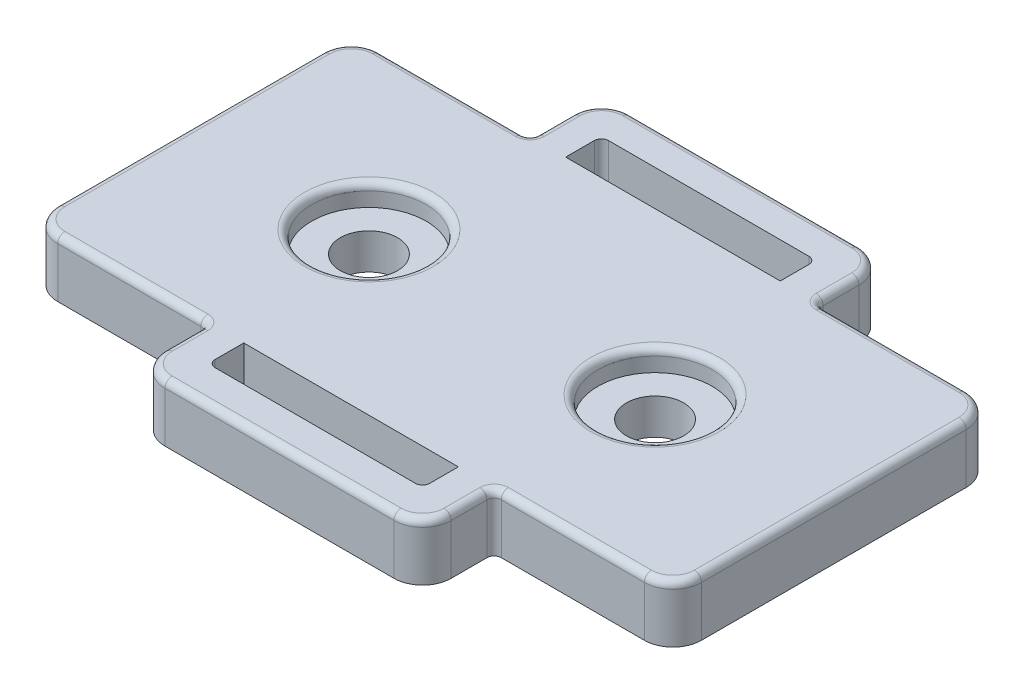
from build123d import *

# Parameters (mm, degrees)
SKETCH_1_R          = 4
EXTRUDE_1_DEPTH     = 8
SKETCH_2_R          = 8
CUT_EXTRUDE_1_DEPTH = 3
CUT_EXTRUDE_2_DEPTH = 3
FILLET_1_R          = 1


with BuildPart() as part:
    # 草图1 → 凸台-拉伸1 (new body)
    with BuildSketch(Plane(origin=(0, 0, 0), x_dir=(1, 0, 0), z_dir=(0, 1, 0))):
        with BuildLine():
            Line((-41, -22.5), (-21, -22.5))
            ThreePointArc((-21, -22.5), (-20.292893219, -22.792893219), (-20, -23.5))
            Line((-20, -23.5), (-20, -28.5))
            ThreePointArc((-20, -28.5), (-18.828427125, -31.328427125), (-16, -32.5))
            Line((-16, -32.5), (16, -32.5))
            ThreePointArc((16, -32.5), (18.828427125, -31.328427125), (20, -28.5))
            Line((20, -28.5), (20, -23.5))
            ThreePointArc((20, -23.5), (20.292893219, -22.792893219), (21, -22.5))
            Line((21, -22.5), (41, -22.5))
            ThreePointArc((41, -22.5), (43.828427125, -21.328427125), (45, -18.5))
            Line((45, -18.5), (45, 18.5))
            ThreePointArc((45, 18.5), (43.828427125, 21.328427125), (41, 22.5))
            Line((41, 22.5), (21, 22.5))
            ThreePointArc((21, 22.5), (20.292893219, 22.792893219), (20, 23.5))
            Line((20, 23.5), (20, 28.5))
            ThreePointArc((20, 28.5), (18.828427125, 31.328427125), (16, 32.5))
            Line((16, 32.5), (-16, 32.5))
            ThreePointArc((-16, 32.5), (-18.828427125, 31.328427125), (-20, 28.5))
            Line((-20, 28.5), (-20, 23.5))
            ThreePointArc((-20, 23.5), (-20.292893219, 22.792893219), (-21, 22.5))
            Line((-21, 22.5), (-41, 22.5))
            ThreePointArc((-41, 22.5), (-43.828427125, 21.328427125), (-45, 18.5))
            Line((-45, 18.5), (-45, -18.5))
            ThreePointArc((-45, -18.5), (-43.828427125, -21.328427125), (-41, -22.5))
        make_face()
        with Locations(Location((-20, 0, 0), (0, 0, 270))):
            Circle(SKETCH_1_R, mode=Mode.SUBTRACT)
        with Locations(Location((20, 0, 0), (0, 0, 270))):
            Circle(SKETCH_1_R, mode=Mode.SUBTRACT)
        with BuildLine():
            Line((-15, 22.5), (-15, 26.5))
            ThreePointArc((-15, 26.5), (-14.707106781, 27.207106781), (-14, 27.5))
            Line((-14, 27.5), (14, 27.5))
            ThreePointArc((14, 27.5), (14.707106781, 27.207106781), (15, 26.5))
            Line((15, 26.5), (15, 22.5))
            Line((15, 22.5), (-15, 22.5))
        make_face(mode=Mode.SUBTRACT)
        with BuildLine():
            Line((15, -26.5), (15, -22.5))
            Line((15, -22.5), (-15, -22.5))
            Line((-15, -22.5), (-15, -26.5))
            ThreePointArc((-15, -26.5), (-14.707106781, -27.207106781), (-14, -27.5))
            Line((-14, -27.5), (14, -27.5))
            ThreePointArc((14, -27.5), (14.707106781, -27.207106781), (15, -26.5))
        make_face(mode=Mode.SUBTRACT)
    extrude(amount=EXTRUDE_1_DEPTH)

    # 草图2 → 切除-拉伸1 (cut)
    with BuildSketch(Plane(origin=(0, 8, 0), x_dir=(1, 0, 0), z_dir=(0, 1, 0))):
        with Locations(Location((-20, 0, 0), (0, 0, 270))):
            Circle(SKETCH_2_R)
        with Locations(Location((20, 0, 0), (0, 0, 270))):
            Circle(SKETCH_2_R)
    extrude(amount=-CUT_EXTRUDE_1_DEPTH, mode=Mode.SUBTRACT)

    # 草图3 → 切除-拉伸2 (cut)
    with BuildSketch(Plane.XZ):
        with BuildLine():
            Line((-8.5, -15), (8.5, -15))
            ThreePointArc((8.5, -15), (11.328427125, -13.828427125), (12.5, -11))
            Line((12.5, -11), (12.5, 11))
            ThreePointArc((12.5, 11), (11.328427125, 13.828427125), (8.5, 15))
            Line((8.5, 15), (-8.5, 15))
            ThreePointArc((-8.5, 15), (-11.328427125, 13.828427125), (-12.5, 11))
            Line((-12.5, 11), (-12.5, -11))
            ThreePointArc((-12.5, -11), (-11.328427125, -13.828427125), (-8.5, -15))
        make_face()
    extrude(amount=-CUT_EXTRUDE_2_DEPTH, mode=Mode.SUBTRACT)

    # 圆角1
    fillet_1_edges = [part.edges().sort_by_distance(p)[0] for p in [
        (-20, 8, -8),
        (20, 8, -8),
        (-20.292893219, 8, 22.792893219),
        (-20, 8, 26),
        (-18.828427125, 8, 31.328427125),
        (0, 8, 32.5),
        (18.828427125, 8, 31.328427125),
        (20, 8, 26),
        (20.292893219, 8, 22.792893219),
        (31, 8, 22.5),
        (43.828427125, 8, 21.328427125),
        (45, 8, 0),
        (-43.828427125, 8, 21.328427125),
        (43.828427125, 8, -21.328427125),
        (31, 8, -22.5),
        (20.292893219, 8, -22.792893219),
        (20, 8, -26),
        (18.828427125, 8, -31.328427125),
        (0, 8, -32.5),
        (-18.828427125, 8, -31.328427125),
        (-20, 8, -26),
        (-20.292893219, 8, -22.792893219),
        (-31, 8, -22.5),
        (-31, 8, 22.5),
        (-43.828427125, 8, -21.328427125),
        (-45, 8, 0),
    ]]
    fillet(fillet_1_edges, radius=FILLET_1_R)


solid = part.part
